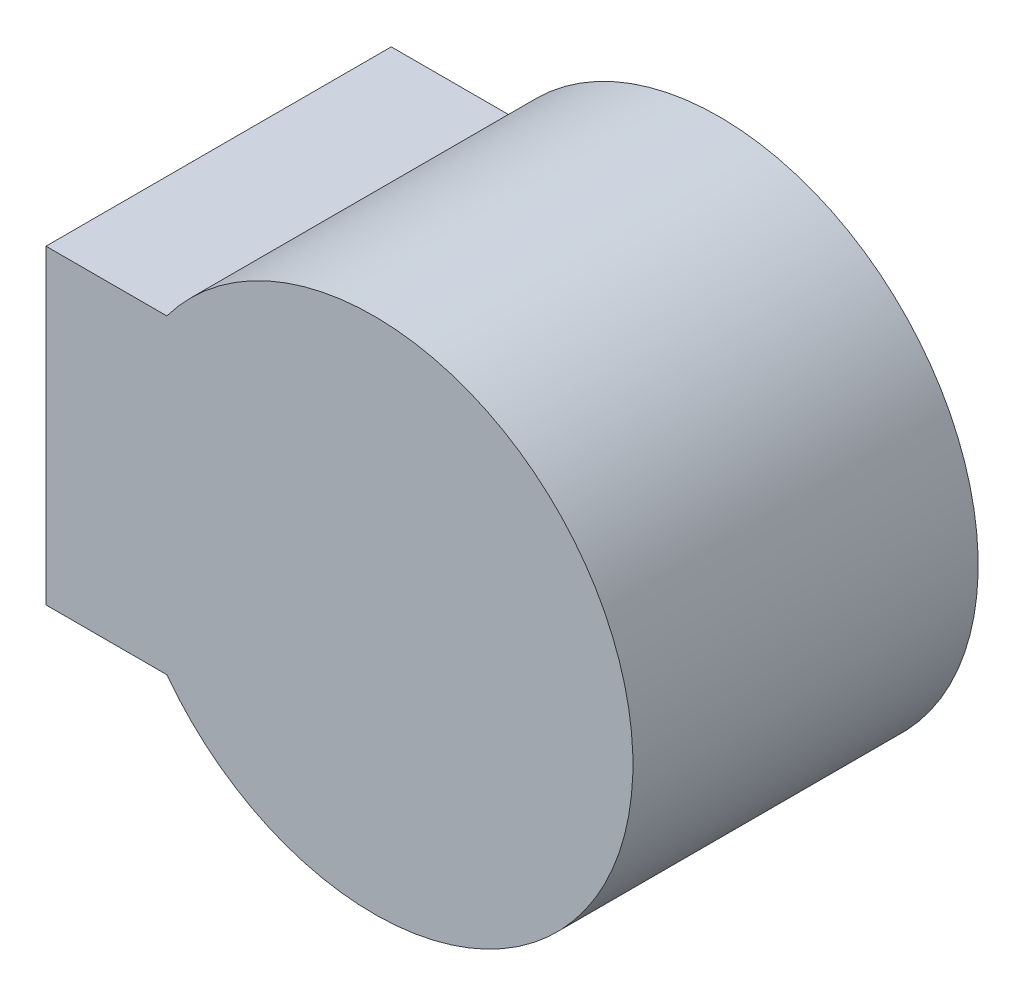
from build123d import *

# Parameters (mm, degrees)
SALIENTE_EXTRUIR1_DEPTH = 10


with BuildPart() as part:
    # Croquis1 → Saliente-Extruir1 (new body)
    with BuildSketch(Plane.XY):
        with BuildLine():
            Line((-9.5, -4.5), (-9.5, 4.5))
            Line((-9.5, 4.5), (-6, 4.5))
            ThreePointArc((-6, 4.5), (7.5, 0), (-6, -4.5))
            Line((-6, -4.5), (-9.5, -4.5))
        make_face()
    extrude(amount=SALIENTE_EXTRUIR1_DEPTH)


solid = part.part
